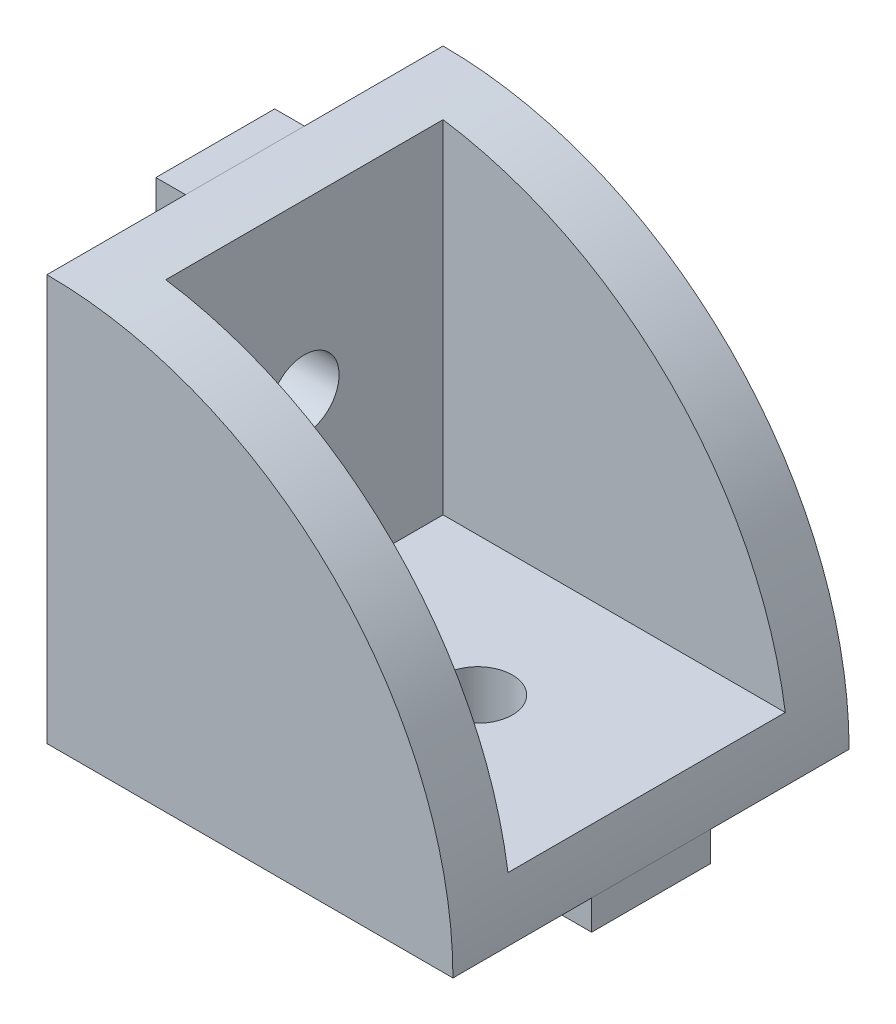
from build123d import *

# Parameters (mm, degrees)
Y_KSEKLIK_EKSTR_ZYON1_DEPTH = 20
KES_EKSTR_ZYON1_START       = 3
IZIM2_W                     = 14
IZIM2_H                     = 17.5
KES_EKSTR_ZYON1_DEPTH       = 33.220732531
IZIM6_W                     = 6
IZIM6_H                     = 1.5
Y_KSEKLIK_EKSTR_ZYON3_DEPTH = 17.5
SKETCH_2_R                  = 1.75
CUT_EXTRUDE_2_DEPTH         = 5
SKETCH_3_W                  = 6
SKETCH_3_H                  = 17.5
EXTRUDE_1_DEPTH             = 1.5
SKETCH_4_R                  = 1.75
CUT_EXTRUDE_3_DEPTH         = 5


with BuildPart() as part:
    # Çizim1 → Yükseklik-Ekstrüzyon1 (new body)
    with BuildSketch(Plane.XY):
        with BuildLine():
            Line((0, 20.5), (0, 0))
            Line((0, 0), (20.5, 0))
            ThreePointArc((20.5, 0), (14.495689014, 14.495689014), (0, 20.5))
        make_face()
    extrude(amount=Y_KSEKLIK_EKSTR_ZYON1_DEPTH)

    # Çizim2 → Kes-Ekstrüzyon1 (cut, through all)
    with BuildSketch(Plane(origin=(0, 0, 0), x_dir=(0, 0, -1), z_dir=(1, 0, 0)).offset(KES_EKSTR_ZYON1_START)):
        with Locations((-10, 11.75)):
            Rectangle(IZIM2_W, IZIM2_H)
    extrude(amount=KES_EKSTR_ZYON1_DEPTH, mode=Mode.SUBTRACT)

    # Çizim6 → Yükseklik-Ekstrüzyon3 (add, through all)
    with BuildSketch(Plane(origin=(3, 0, 0), x_dir=(0, 0, -1), z_dir=(1, 0, 0))):
        with Locations((-10, -0.75)):
            Rectangle(IZIM6_W, IZIM6_H)
    extrude(amount=Y_KSEKLIK_EKSTR_ZYON3_DEPTH)

    # Эскиз2 → Вырез-Вытянуть2 (cut)
    with BuildSketch(Plane.XZ.offset(1.5)):
        with Locations(Location((11.75, 10, 0), (0, 0, 270))):
            Circle(SKETCH_2_R)
    extrude(amount=-CUT_EXTRUDE_2_DEPTH, mode=Mode.SUBTRACT)

    # Эскиз3 → Бобышка-Вытянуть1 (add)
    with BuildSketch(Plane.ZY):
        with Locations((10, 11.75)):
            Rectangle(SKETCH_3_W, SKETCH_3_H)
    extrude(amount=EXTRUDE_1_DEPTH)

    # Эскиз4 → Вырез-Вытянуть3 (cut)
    with BuildSketch(Plane.ZY.offset(1.5)):
        with Locations(Location((10, 11.75, 0), (0, 0, 270))):
            Circle(SKETCH_4_R)
    extrude(amount=-CUT_EXTRUDE_3_DEPTH, mode=Mode.SUBTRACT)


solid = part.part
